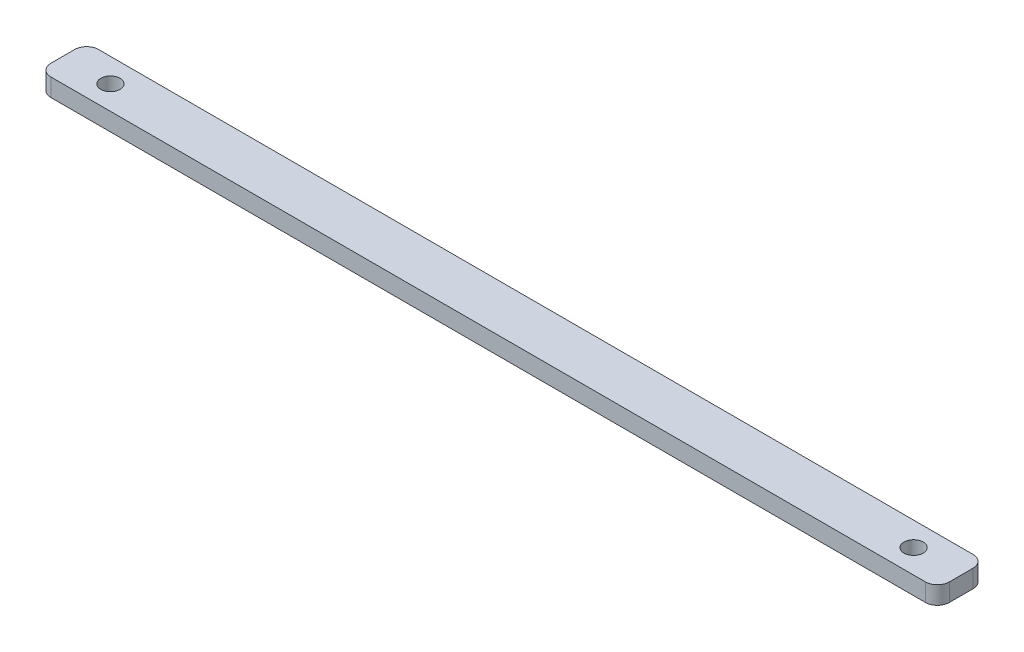
from build123d import *

# Parameters (mm, degrees)
SKETCH1_W           = 151
SKETCH1_H           = 8
SKETCH1_R           = 1.621
BOSS_EXTRUDE1_DEPTH = 3
FILLET1_R           = 2


with BuildPart() as part:
    # Sketch1 → Boss-Extrude1 (new body)
    with BuildSketch(Plane(origin=(0, 0, 0), x_dir=(1, 0, 0), z_dir=(0, 1, 0))):
        Rectangle(SKETCH1_W, SKETCH1_H)
        with Locations(Location((-67.5, 0, 0), (0, 0, 270))):
            Circle(SKETCH1_R, mode=Mode.SUBTRACT)
        with Locations(Location((67.5, 0, 0), (0, 0, 270))):
            Circle(SKETCH1_R, mode=Mode.SUBTRACT)
    extrude(amount=BOSS_EXTRUDE1_DEPTH)

    # Fillet1
    fillet1_edges = [part.edges().sort_by_distance(p)[0] for p in [
        (-75.5, 1.5, -4),
        (75.5, 1.5, -4),
        (75.5, 1.5, 4),
        (-75.5, 1.5, 4),
    ]]
    fillet(fillet1_edges, radius=FILLET1_R)


solid = part.part
